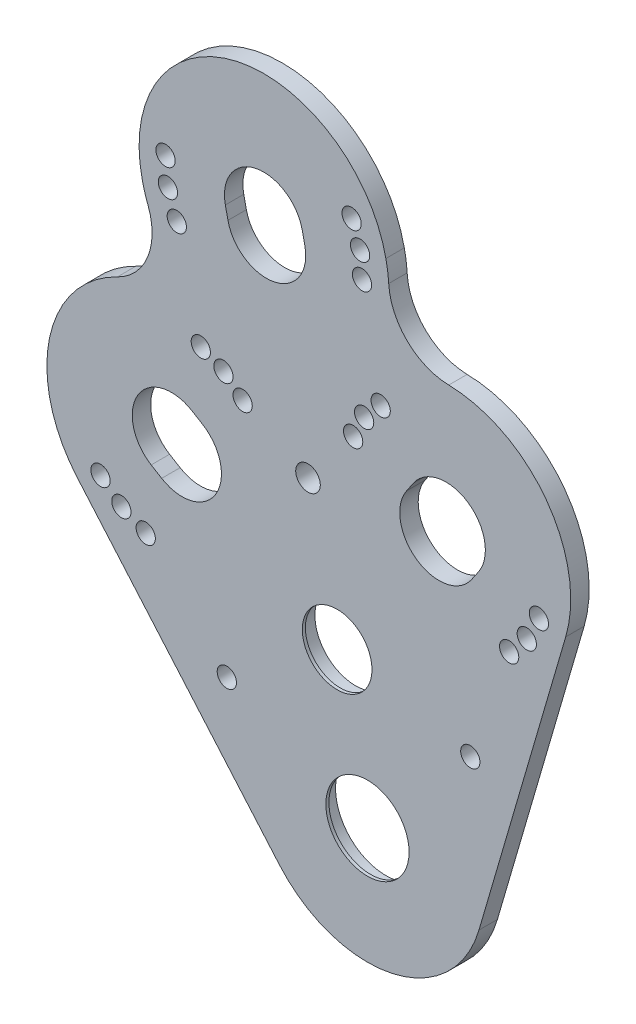
from build123d import *

# Parameters (mm, degrees)
SKETCH1_R              = 3.175
SKETCH1_R_2            = 10.499999955
SKETCH1_R_3            = 13.000000035
BOSS_EXTRUDE4_DEPTH    = 4.7625
F_10_CLEARANCE_HOLE3_D = 4.9784
SKETCH1_13_R           = 10.499999955
SKETCH1_13_R_2         = 9.000000034
SKETCH1_13_R_3         = 13.000000035
SKETCH1_13_R_4         = 10.750000026
BOSS_EXTRUDE5_DEPTH    = 0.79375


with BuildPart() as part:
    # Sketch1 → Boss-Extrude4 (new body)
    with BuildSketch(Plane.XY):
        with BuildLine():
            ThreePointArc((-58.191391536, 116.105526376), (-57.54504783, 113.543750167), (-56.690905362, 111.043570538))
            ThreePointArc((-56.690905362, 111.043570538), (-56.720922919, 99.478750551), (-64.589116092, 91.003050074))
            ThreePointArc((-64.589116092, 91.003050074), (-82.123671946, 68.541010041), (-74.972043993, 40.957353485))
            Line((-74.972043993, 40.957353485), (-22.715793489, -19.601472909))
            ThreePointArc((-22.715793489, -19.601472909), (6.372007721, -29.319320109), (28.80246523, -8.404939663))
            Line((28.80246523, -8.404939663), (51.209487117, 68.380557282))
            ThreePointArc((51.209487117, 68.380557282), (46.267175411, 96.444367544), (20.991271172, 109.60235205))
            ThreePointArc((20.991271172, 109.60235205), (10.314919955, 114.047741469), (5.487535559, 124.556895683))
            ThreePointArc((5.487535559, 124.556895683), (5.226909628, 127.186065068), (4.751663289, 129.785026101))
            ThreePointArc((4.751663289, 129.785026101), (-33.61376962, 154.665988281), (-58.191391536, 116.105526376))
        make_face()
        with BuildLine():
            Line((-36.027755896, 117.933191666), (-36.702042427, 121.035765223))
            ThreePointArc((-36.702042427, 121.035765223), (-28.931523946, 133.121717504), (-16.845571665, 125.351199024))
            Line((-16.845571665, 125.351199024), (-16.171285134, 122.248625467))
            ThreePointArc((-16.171285134, 122.248625467), (-23.941803614, 110.162673186), (-36.027755896, 117.933191666))
        make_face(mode=Mode.SUBTRACT)
        with Locations((-15.353270713, 70.644524994)):
            Circle(SKETCH1_R, mode=Mode.SUBTRACT)
        with Locations((-7.832512348, 36.039494433)):
            Circle(SKETCH1_R_2, mode=Mode.SUBTRACT)
        with BuildLine():
            ThreePointArc((-42.601236178, 69.035207713), (-39.189447533, 55.07774024), (-53.146915005, 51.665951595))
            Line((-53.146915005, 51.665951595), (-55.860861274, 53.313713912))
            ThreePointArc((-55.860861274, 53.313713912), (-59.272649919, 67.271181384), (-45.315182446, 70.682970029))
            Line((-45.315182446, 70.682970029), (-42.601236178, 69.035207713))
        make_face(mode=Mode.SUBTRACT)
        with BuildLine():
            ThreePointArc((26.90840537, 69.064483269), (12.793882636, 66.375348097), (10.104747464, 80.489870832))
            Line((10.104747464, 80.489870832), (11.88996427, 83.11544238))
            ThreePointArc((11.88996427, 83.11544238), (26.004487005, 85.804577552), (28.693622177, 71.690054817))
            Line((28.693622177, 71.690054817), (26.90840537, 69.064483269))
        make_face(mode=Mode.SUBTRACT)
        Circle(SKETCH1_R_3, mode=Mode.SUBTRACT)
    extrude(amount=-BOSS_EXTRUDE4_DEPTH)

    # #10 Clearance Hole3 (through all)
    with Locations(Plane.XY):
        with Locations((3.413684473, 96.21413667), (-43.040228891, 86.118244489), (-37.188807624, 83.578091132), (-32.235724588, 79.55833015), (-3.693450585, 85.761461384), (-0.855596504, 91.474437328), (36.598632596, 57.751177631), (41.153548262, 62.910968421), (44.277037033, 69.044035813), (26.566795152, 29.269907275), (-36.319050549, 15.602840887), (-57.267352023, 37.351155511), (-63.553004693, 40.154950839), (-68.940319132, 44.438353792), (-49.244623041, 111.062543152), (-51.540452576, 117.550983988), (-52.144800025, 124.407036926), (-1.402814067, 121.979927321), (-1.899275671, 128.33956849), (-4.087219361, 134.331597556)):
            Hole(F_10_CLEARANCE_HOLE3_D / 2)

    # Sketch1<13> → Boss-Extrude5 (add)
    # profile 1 of 2: a face of its own
    with BuildSketch(Plane.XY):
        with Locations((-7.832512348, 36.039494433)):
            Circle(SKETCH1_13_R)
        with Locations((-7.832512348, 36.039494433)):
            Circle(SKETCH1_13_R_2, mode=Mode.SUBTRACT)
    # profile 2 of 2: a face of its own
    with BuildSketch(Plane.XY):
        Circle(SKETCH1_13_R_3)
        Circle(SKETCH1_13_R_4, mode=Mode.SUBTRACT)
    extrude(amount=-BOSS_EXTRUDE5_DEPTH)


solid = part.part
